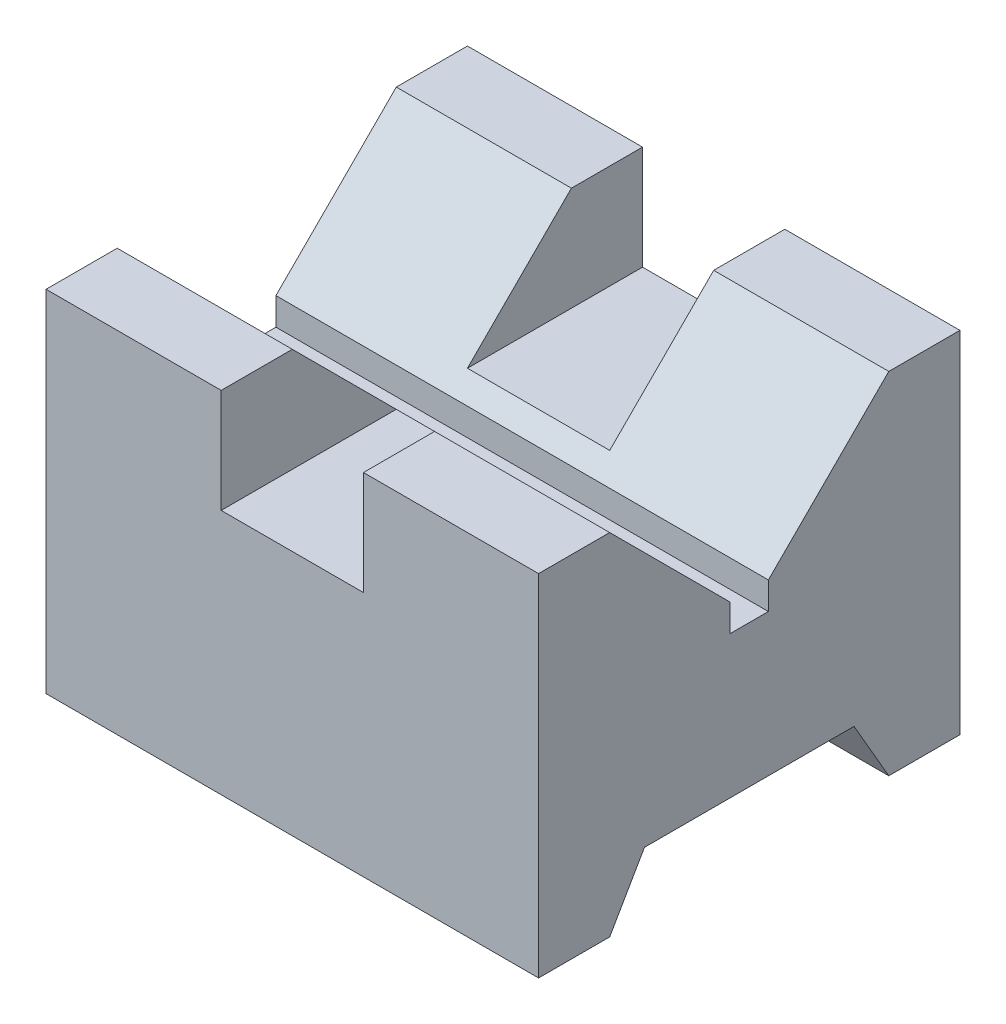
from build123d import *

# Parameters (mm, degrees)
IZIM6_W                     = 900
IZIM6_H                     = 640
Y_KSEKLIK_EKSTR_ZYON3_DEPTH = 770
IZIM7_W                     = 260
IZIM7_H                     = 190
KES_EKSTR_ZYON4_DEPTH       = 770
KES_EKSTR_ZYON6_REACH       = 1228.907
KES_EKSTR_ZYON7_DEPTH       = 900


with BuildPart() as part:
    # Çizim6 → Yükseklik-Ekstrüzyon3 (new body)
    with BuildSketch(Plane.XY):
        Rectangle(IZIM6_W, IZIM6_H)
    extrude(amount=Y_KSEKLIK_EKSTR_ZYON3_DEPTH)

    # Çizim7 → Kes-Ekstrüzyon4 (cut)
    with BuildSketch(Plane.XY.offset(770)):
        with Locations((0, 225)):
            Rectangle(IZIM7_W, IZIM7_H)
    extrude(amount=-KES_EKSTR_ZYON4_DEPTH, mode=Mode.SUBTRACT)

    # Kes-Ekstrüzyon6: up to this face of the body (flat: up to its plane)
    kes_ekstr_zyon6_end = Plane(part.part.faces().sort_by_distance((-450, 0, 385))[0])
    # Çizim8 → Kes-Ekstrüzyon6 (cut, up to the picked face)
    with BuildSketch(Plane(origin=(450, 0, 0), x_dir=(0, 0, -1), z_dir=(1, 0, 0)), mode=Mode.PRIVATE) as kes_ekstr_zyon6_sk1:
        Polygon((-350, 50), (-350, 100), (-130, 320), (-640, 320), (-420, 100), (-420, 50), align=None)
    kes_ekstr_zyon6_tool1 = split(extrude(kes_ekstr_zyon6_sk1.sketch, amount=-KES_EKSTR_ZYON6_REACH, mode=Mode.PRIVATE), bisect_by=kes_ekstr_zyon6_end, keep=Keep.BOTH, mode=Mode.PRIVATE)
    add(kes_ekstr_zyon6_tool1.solids().sort_by(Axis((450, 229.348687, 385), (-1, 0, 0)))[0], mode=Mode.SUBTRACT)

    # Çizim13 → Kes-Ekstrüzyon7 (cut)
    with BuildSketch(Plane(origin=(450, 0, 0), x_dir=(0, 0, -1), z_dir=(1, 0, 0))):
        Polygon((-640, -320), (-576.491470389, -210), (-193.508529611, -210), (-130, -320), align=None)
    extrude(amount=-KES_EKSTR_ZYON7_DEPTH, mode=Mode.SUBTRACT)


solid = part.part
